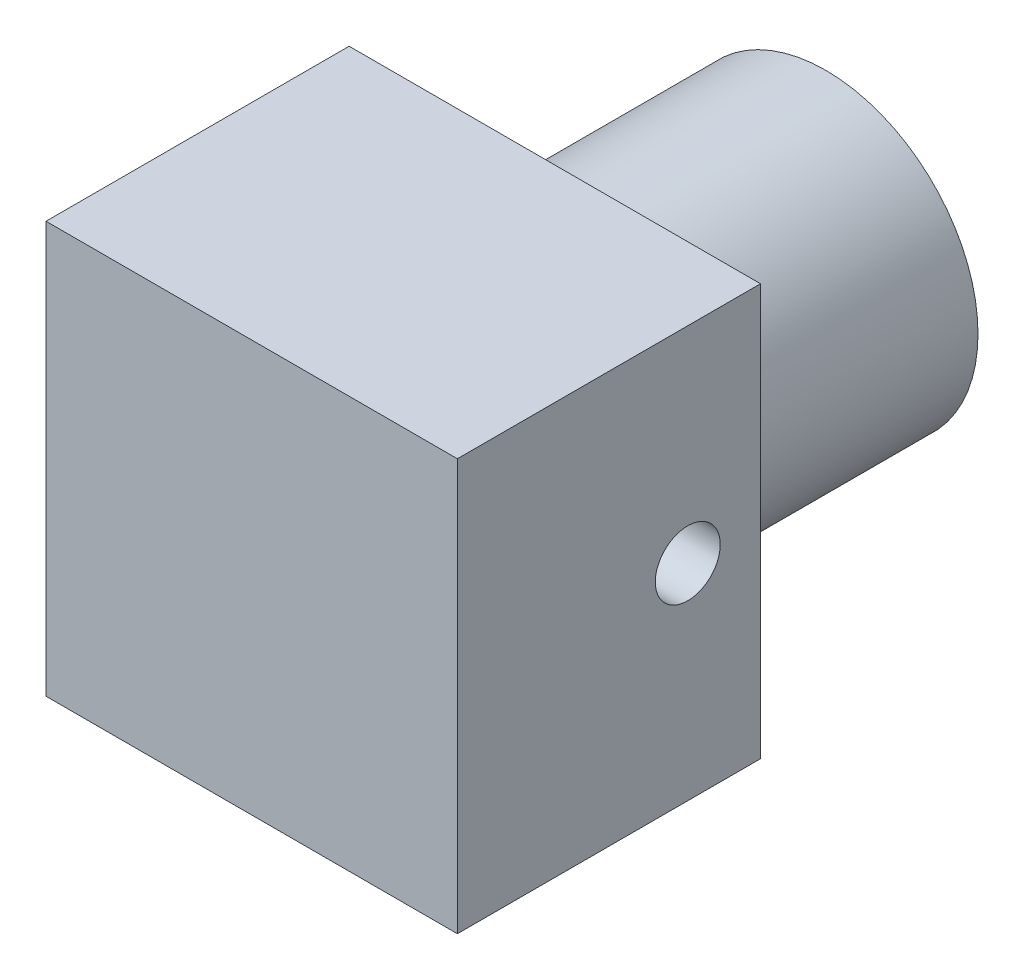
from build123d import *

# Parameters (mm, degrees)
SKETCH_1_R          = 7.025
EXTRUDE_1_DEPTH     = 12.52
SKETCH_2_W          = 19
SKETCH_2_H          = 19
EXTRUDE_2_DEPTH     = 14
SKETCH_3_R          = 1.5
CUT_EXTRUDE_1_DEPTH = 34.978822817


with BuildPart() as part:
    # 草图1 → 凸台-拉伸1 (new body)
    with BuildSketch(Plane.XY):
        Circle(SKETCH_1_R)
    extrude(amount=EXTRUDE_1_DEPTH)

    # 草图2 → 凸台-拉伸2 (add)
    with BuildSketch(Plane.XY.offset(12.52)):
        Rectangle(SKETCH_2_W, SKETCH_2_H)
    extrude(amount=EXTRUDE_2_DEPTH)

    # 草图3 → 切除-拉伸1 (cut, through all)
    with BuildSketch(Plane.ZY.offset(9.5)):
        with Locations((15.88, 0)):
            Circle(SKETCH_3_R)
    extrude(amount=-CUT_EXTRUDE_1_DEPTH, mode=Mode.SUBTRACT)


solid = part.part
